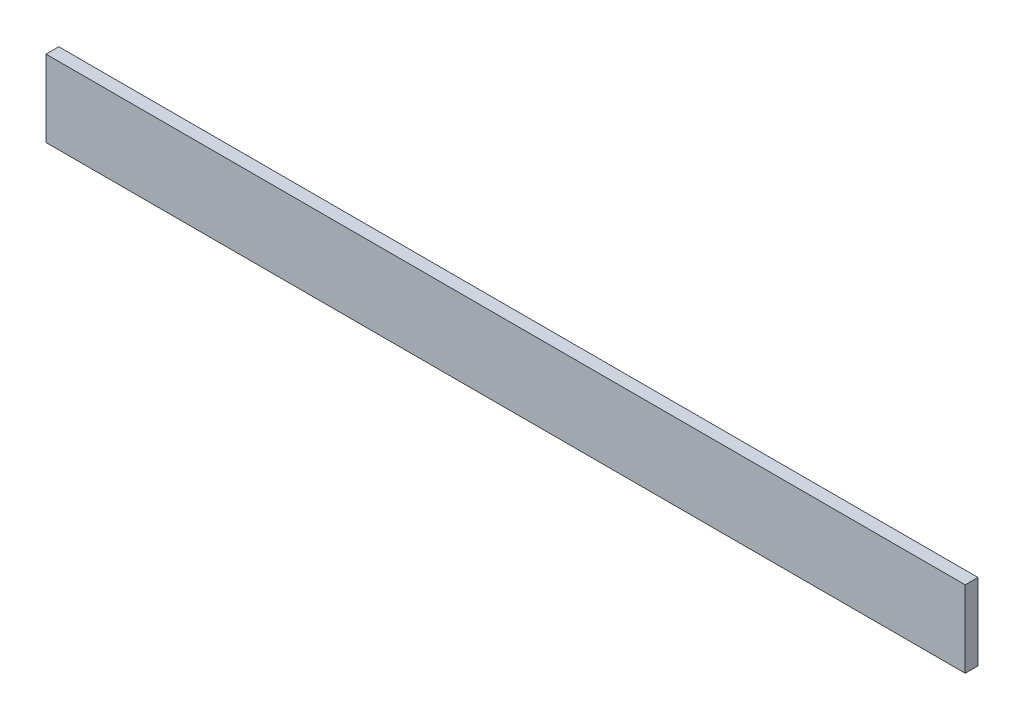
from build123d import *

# Parameters (mm, degrees)
SKETCH1_W           = 50.8
SKETCH1_H           = 304.8
BOSS_EXTRUDE1_DEPTH = 3657.6


with BuildPart() as part:
    # Sketch1 → Boss-Extrude1 (new body)
    with BuildSketch(Plane(origin=(0, 0, 0), x_dir=(0, 0, -1), z_dir=(1, 0, 0))):
        with Locations((25.4, 152.4)):
            Rectangle(SKETCH1_W, SKETCH1_H)
    extrude(amount=BOSS_EXTRUDE1_DEPTH)


solid = part.part
